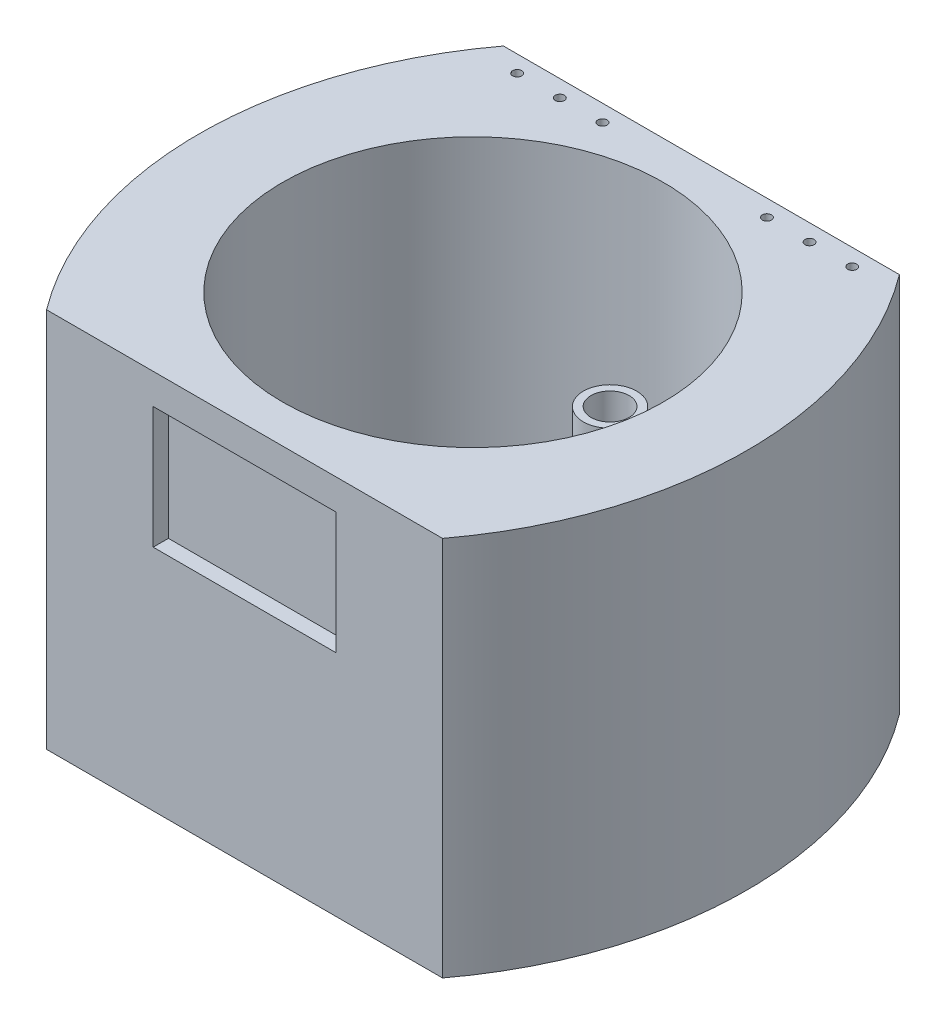
from build123d import *

# Parameters (mm, degrees)
BOSS_EXTRUDE1_DEPTH      = 250
INSIDE_COMPARTMENT_R     = 125
CUT_EXTRUDE1_DEPTH       = 240
LCD_W                    = 120
LCD_H                    = 80
CUT_EXTRUDE2_DEPTH       = 10
HINGE_HOLES_R            = 3
CUT_EXTRUDE3_DEPTH       = 20
POWER_SUPPLY_HOLES_R     = 3.5
CUT_EXTRUDE4_DEPTH       = 336.410196625
POLES_FOR_MIDDLE_LAYER_R = 17.5
BOSS_EXTRUDE2_DEPTH      = 130
HOLES_FOR_POLES_R        = 12.5
CUT_EXTRUDE6_DEPTH       = 50


with BuildPart() as part:
    # Case 2 → Boss-Extrude1 (new body)
    with BuildSketch(Plane(origin=(0, 0, 0), x_dir=(1, 0, 0), z_dir=(0, 1, 0))):
        with BuildLine():
            Line((-130, 150), (130, 150))
            ThreePointArc((130, 150), (180, 0), (130, -150))
            Line((130, -150), (-130, -150))
            ThreePointArc((-130, -150), (-180, 0), (-130, 150))
        make_face()
    extrude(amount=BOSS_EXTRUDE1_DEPTH)

    # Inside Compartment → Cut-Extrude1 (cut)
    with BuildSketch(Plane(origin=(0, 250, 0), x_dir=(1, 0, 0), z_dir=(0, 1, 0))):
        with Locations(Location((0, 0, 0), (0, 0, 270))):
            Circle(INSIDE_COMPARTMENT_R)
    extrude(amount=-CUT_EXTRUDE1_DEPTH, mode=Mode.SUBTRACT)

    # LCD → Cut-Extrude2 (cut)
    with BuildSketch(Plane.XY.offset(150)):
        with Locations((0, 190)):
            Rectangle(LCD_W, LCD_H)
    extrude(amount=-CUT_EXTRUDE2_DEPTH, mode=Mode.SUBTRACT)

    # Hinge holes → Cut-Extrude3 (cut)
    with BuildSketch(Plane(origin=(0, 250, 0), x_dir=(1, 0, 0), z_dir=(0, 1, 0))):
        with Locations(Location((-110, 139, 0), (0, 0, 270))):
            Circle(HINGE_HOLES_R)
        with Locations(Location((-82, 139, 0), (0, 0, 270))):
            Circle(HINGE_HOLES_R)
        with Locations(Location((-54, 139, 0), (0, 0, 270))):
            Circle(HINGE_HOLES_R)
        with Locations(Location((54, 139, 0), (0, 0, 270))):
            Circle(HINGE_HOLES_R)
        with Locations(Location((82, 139, 0), (0, 0, 270))):
            Circle(HINGE_HOLES_R)
        with Locations(Location((110, 139, 0), (0, 0, 270))):
            Circle(HINGE_HOLES_R)
    extrude(amount=-CUT_EXTRUDE3_DEPTH, mode=Mode.SUBTRACT)

    # Power supply holes → Cut-Extrude4 (cut, through all)
    with BuildSketch(Plane(origin=(0, 10, 0), x_dir=(1, 0, 0), z_dir=(0, 1, 0))):
        with Locations(Location((-82.5, 40, 0), (0, 0, 270))):
            Circle(POWER_SUPPLY_HOLES_R)
        with Locations(Location((37.5, 40, 0), (0, 0, 270))):
            Circle(POWER_SUPPLY_HOLES_R)
        with Locations(Location((37.5, -40, 0), (0, 0, 270))):
            Circle(POWER_SUPPLY_HOLES_R)
        with Locations(Location((-82.5, -40, 0), (0, 0, 270))):
            Circle(POWER_SUPPLY_HOLES_R)
    extrude(amount=-CUT_EXTRUDE4_DEPTH, mode=Mode.SUBTRACT)

    # Poles for middle layer → Boss-Extrude2 (add)
    with BuildSketch(Plane(origin=(0, 10, 0), x_dir=(1, 0, 0), z_dir=(0, 1, 0))):
        with Locations(Location((0, 90, 0), (0, 0, 270))):
            Circle(POLES_FOR_MIDDLE_LAYER_R)
        with Locations(Location((0, -90, 0), (0, 0, 270))):
            Circle(POLES_FOR_MIDDLE_LAYER_R)
    extrude(amount=BOSS_EXTRUDE2_DEPTH)

    # Holes for poles → Cut-Extrude6 (cut)
    with BuildSketch(Plane(origin=(0, 140, 0), x_dir=(1, 0, 0), z_dir=(0, 1, 0))):
        with Locations(Location((0, -90, 0), (0, 0, 270))):
            Circle(HOLES_FOR_POLES_R)
        with Locations(Location((0, 90, 0), (0, 0, 270))):
            Circle(HOLES_FOR_POLES_R)
    extrude(amount=-CUT_EXTRUDE6_DEPTH, mode=Mode.SUBTRACT)


solid = part.part
